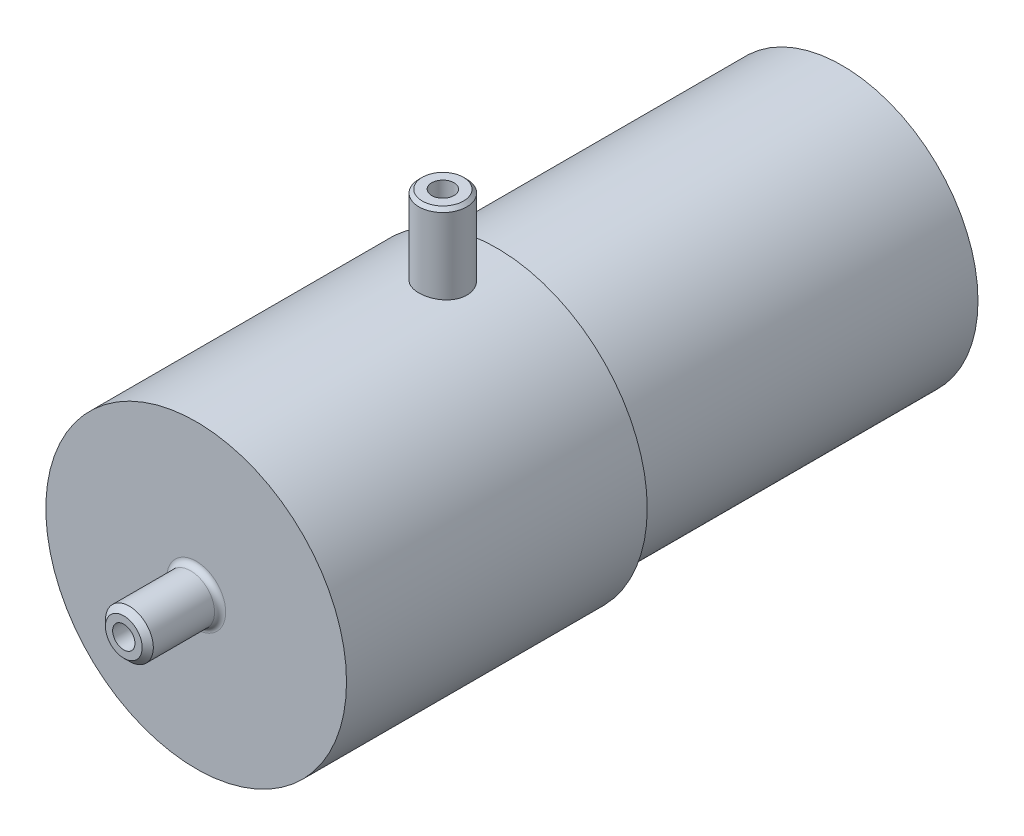
from build123d import *

# Parameters (mm, degrees)
CROQUIS1_R                               = 12.2
SALIENTE_EXTRUIR1_DEPTH                  = 31
CROQUIS2_R                               = 13.5
SALIENTE_EXTRUIR2_DEPTH                  = 27
CROQUIS3_R                               = 2.15
CROQUIS3_R_2                             = 1
SALIENTE_EXTRUIR3_DEPTH                  = 6.5
CHAFL_N2_SIZE                            = 0.5
REDONDEO1_R                              = 0.5
CROQUIS5_R                               = 2.15
CROQUIS5_R_2                             = 1
SALIENTE_EXTRUIR4_DEPTH                  = 7
SALIENTE_EXTRUIR4_DIRECTION_2_REACH      = 73.214
SALIENTE_EXTRUIR4_DIRECTION_2_END_RADIUS = 13.5
CHAFL_N3_SIZE                            = 0.3
CROQUIS6_R                               = 3
SALIENTE_EXTRUIR5_DEPTH                  = 2
REDONDEO2_R                              = 1


with BuildPart() as part:
    # Croquis1 → Saliente-Extruir1 (new body)
    with BuildSketch(Plane.XY):
        Circle(CROQUIS1_R)
    extrude(amount=SALIENTE_EXTRUIR1_DEPTH)

    # Croquis2 → Saliente-Extruir2 (add)
    with BuildSketch(Plane.XY.offset(31)):
        Circle(CROQUIS2_R)
    extrude(amount=SALIENTE_EXTRUIR2_DEPTH)

    # Croquis3 → Saliente-Extruir3 (add)
    with BuildSketch(Plane.XY.offset(58)):
        with Locations(Location((0, 0, 0), (0, 0, 180))):
            Circle(CROQUIS3_R)
        with Locations(Location((0, 0, 0), (0, 0, 180))):
            Circle(CROQUIS3_R_2, mode=Mode.SUBTRACT)
    extrude(amount=SALIENTE_EXTRUIR3_DEPTH)

    # Chaflán2
    chafl_n2_edges = [part.edges().sort_by_distance(p)[0] for p in [
        (2.15, 0, 64.5),
    ]]
    chamfer(chafl_n2_edges, length=CHAFL_N2_SIZE)

    # Redondeo1
    redondeo1_edges = [part.edges().sort_by_distance(p)[0] for p in [
        (2.15, 0, 58),
    ]]
    fillet(redondeo1_edges, radius=REDONDEO1_R)

    # Croquis5 → Saliente-Extruir4 (add)
    with BuildSketch(Plane(origin=(0, 13.5, 0), x_dir=(1, 0, 0), z_dir=(0, 1, 0))):
        with Locations(Location((0, -35.85, 0), (0, 0, 90))):
            Circle(CROQUIS5_R)
        with Locations(Location((0, -35.85, 0), (0, 0, 270))):
            Circle(CROQUIS5_R_2, mode=Mode.SUBTRACT)
    extrude(amount=SALIENTE_EXTRUIR4_DEPTH)

    # Saliente-Extruir4 direction 2: up to this cylinder (the profile starts outside it)
    saliente_extruir4_direction_2_end = Plane(origin=(0, 0, 37.939189), z_dir=(0, 0, -1)) * Cylinder(SALIENTE_EXTRUIR4_DIRECTION_2_END_RADIUS, 174.428, mode=Mode.PRIVATE)
    # Croquis5 → Saliente-Extruir4 direction 2 (add, up to the surface)
    with BuildSketch(Plane(origin=(0, 13.5, 0), x_dir=(1, 0, 0), z_dir=(0, 1, 0)), mode=Mode.PRIVATE) as saliente_extruir4_direction_2_sk1:
        with Locations(Location((0, -35.85, 0), (0, 0, 90))):
            Circle(CROQUIS5_R)
        with Locations(Location((0, -35.85, 0), (0, 0, 270))):
            Circle(CROQUIS5_R_2, mode=Mode.SUBTRACT)
    saliente_extruir4_direction_2_tool1 = extrude(saliente_extruir4_direction_2_sk1.sketch, amount=-SALIENTE_EXTRUIR4_DIRECTION_2_REACH, mode=Mode.PRIVATE) - saliente_extruir4_direction_2_end
    add(saliente_extruir4_direction_2_tool1.solids().sort_by_distance((0, 13.5, 37.939189))[0])
    add(saliente_extruir4_direction_2_tool1.solids().sort_by_distance((0, 13.5, 37.939189))[1])

    # Chaflán3
    chafl_n3_edges = [part.edges().sort_by_distance(p)[0] for p in [
        (0, 20.5, 38),
    ]]
    chamfer(chafl_n3_edges, length=CHAFL_N3_SIZE)

    # Croquis6 → Saliente-Extruir5 (add)
    with BuildSketch(Plane(origin=(0, 0, 0), x_dir=(-1, 0, 0), z_dir=(0, 0, -1))):
        Circle(CROQUIS6_R)
    extrude(amount=SALIENTE_EXTRUIR5_DEPTH)

    # Redondeo2
    redondeo2_edges = [part.edges().sort_by_distance(p)[0] for p in [
        (3, 0, -2),
    ]]
    fillet(redondeo2_edges, radius=REDONDEO2_R)


solid = part.part
